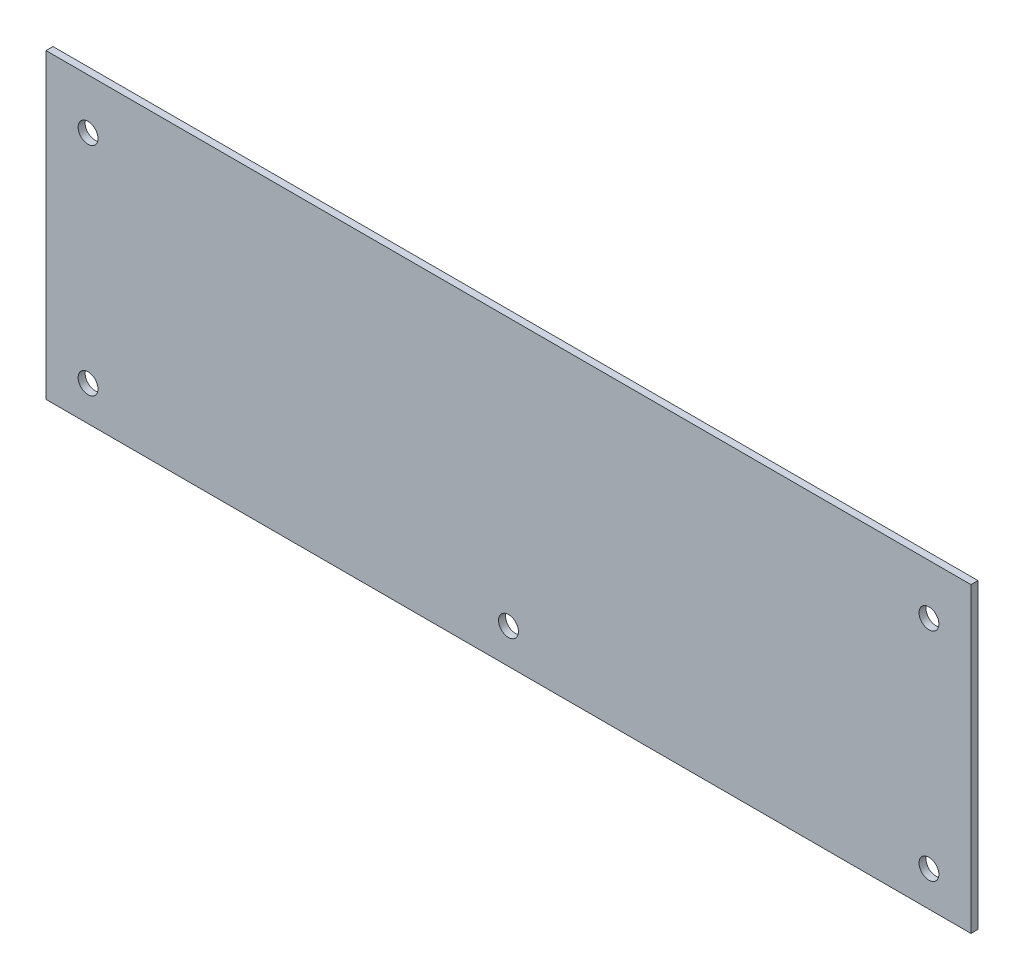
from build123d import *

# Parameters (mm, degrees)
SKETCH1_R               = 4
BOSS_EXTRUDE1_DEPTH     = 3
CROQUIS1_W              = 29
CROQUIS1_H              = 43
SALIENTE_EXTRUIR1_DEPTH = 3
CROQUIS2_R              = 4.25
CORTAR_EXTRUIR1_DEPTH   = 3
CROQUIS4_W              = 3.35
CROQUIS4_H              = 129.34
CORTAR_EXTRUIR2_DEPTH   = 3
CROQUIS5_R              = 4.5
SALIENTE_EXTRUIR2_DEPTH = 3
CROQUIS6_R              = 4.25
CORTAR_EXTRUIR3_DEPTH   = 3


with BuildPart() as part:
    # Sketch1 → Boss-Extrude1 (new body)
    with BuildSketch(Plane.XY):
        Polygon((0, 0), (402.7, 0), (402.7, 86.34), (373.7, 86.34), (373.7, 129.34), (29, 129.34), (29, 86.34), (0, 86.34), align=None)
        with Locations((21.35, 71.34)):
            Circle(SKETCH1_R, mode=Mode.SUBTRACT)
        with Locations((21.35, 15)):
            Circle(SKETCH1_R, mode=Mode.SUBTRACT)
        with Locations((381.35, 15)):
            Circle(SKETCH1_R, mode=Mode.SUBTRACT)
        with Locations((381.35, 71.34)):
            Circle(SKETCH1_R, mode=Mode.SUBTRACT)
        with Locations((199, 15)):
            Circle(SKETCH1_R, mode=Mode.SUBTRACT)
    extrude(amount=BOSS_EXTRUDE1_DEPTH)

    # Croquis1 → Saliente-Extruir1 (add)
    with BuildSketch(Plane.XY.offset(3)):
        with Locations((14.5, 107.84)):
            Rectangle(CROQUIS1_W, CROQUIS1_H)
        with Locations((388.2, 107.84)):
            Rectangle(CROQUIS1_W, CROQUIS1_H)
    extrude(amount=-SALIENTE_EXTRUIR1_DEPTH)

    # Croquis2 → Cortar-Extruir1 (cut)
    with BuildSketch(Plane.XY.offset(3)):
        with Locations((15, 107.84)):
            Circle(CROQUIS2_R)
        with Locations((387.7, 107.84)):
            Circle(CROQUIS2_R)
    extrude(amount=-CORTAR_EXTRUIR1_DEPTH, mode=Mode.SUBTRACT)

    # Croquis4 → Cortar-Extruir2 (cut)
    with BuildSketch(Plane.XY.offset(3)):
        with Locations((1.675, 64.67)):
            Rectangle(CROQUIS4_W, CROQUIS4_H)
        with Locations((401.025, 64.67)):
            Rectangle(CROQUIS4_W, CROQUIS4_H)
    extrude(amount=-CORTAR_EXTRUIR2_DEPTH, mode=Mode.SUBTRACT)

    # Croquis5 → Saliente-Extruir2 (add)
    with BuildSketch(Plane.XY.offset(3)):
        with Locations((199, 15)):
            Circle(CROQUIS5_R)
        with Locations((21.35, 15)):
            Circle(CROQUIS5_R)
        with Locations((21.35, 71.34)):
            Circle(CROQUIS5_R)
        with Locations((15, 107.84)):
            Circle(CROQUIS5_R)
        with Locations((387.7, 107.84)):
            Circle(CROQUIS5_R)
        with Locations((381.35, 71.34)):
            Circle(CROQUIS5_R)
        with Locations((381.35, 15)):
            Circle(CROQUIS5_R)
    extrude(amount=-SALIENTE_EXTRUIR2_DEPTH)

    # Croquis6 → Cortar-Extruir3 (cut)
    with BuildSketch(Plane.XY.offset(3)):
        with Locations((21.35, 107.84)):
            Circle(CROQUIS6_R)
        with Locations((21.35, 15)):
            Circle(CROQUIS6_R)
        with Locations((201.35, 15)):
            Circle(CROQUIS6_R)
        with Locations((381.35, 15)):
            Circle(CROQUIS6_R)
        with Locations((381.35, 107.84)):
            Circle(CROQUIS6_R)
    extrude(amount=-CORTAR_EXTRUIR3_DEPTH, mode=Mode.SUBTRACT)


solid = part.part
